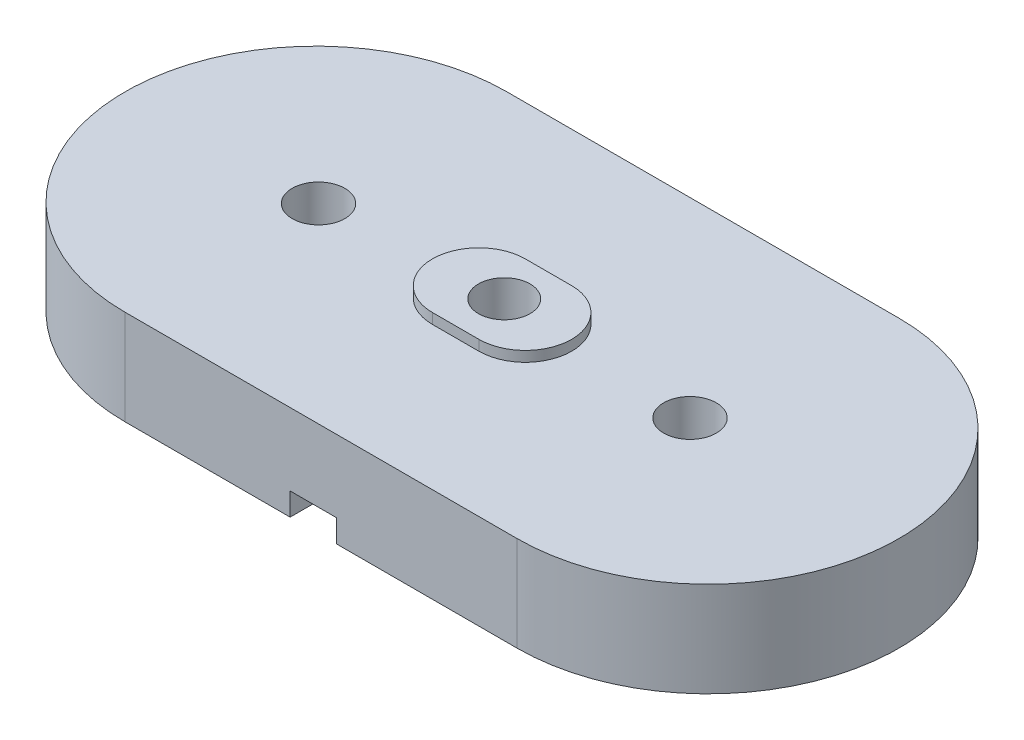
from build123d import *

# Parameters (mm, degrees)
BOSS_EXTRUDE1_DEPTH     = 46
CUT_EXTRUDE1_DEPTH      = 11
SKETCH3_R               = 12.5
CUT_EXTRUDE2_DEPTH      = 300.311710429
SKETCH4_R               = 12.5
BOSS_EXTRUDE2_DEPTH     = 5
CUT_EXTRUDE3_DEPTH      = 301.796442798
CUT_EXTRUDE3_DEPTH_BACK = 301.796442798
SKETCH5_R               = 12.75


with BuildPart() as part:
    # Sketch1 → Boss-Extrude1 (new body)
    with BuildSketch(Plane(origin=(0, 0, 0), x_dir=(1, 0, 0), z_dir=(0, 1, 0))):
        with BuildLine():
            Line((0, 92.5), (190, 92.5))
            ThreePointArc((190, 92.5), (282.5, 0), (190, -92.5))
            Line((190, -92.5), (0, -92.5))
            ThreePointArc((0, -92.5), (-92.5, 0), (0, 92.5))
        make_face()
    extrude(amount=BOSS_EXTRUDE1_DEPTH)

    # Sketch2 → Cut-Extrude1 (cut)
    with BuildSketch(Plane.XZ):
        with BuildLine():
            Line((80, -92.5), (80, -22.5))
            ThreePointArc((80, -22.5), (57.5, 0), (80, 22.5))
            Line((80, 22.5), (80, 92.5))
            Line((80, 92.5), (102.5, 92.5))
            Line((102.5, 92.5), (102.5, 22.5))
            ThreePointArc((102.5, 22.5), (125, 0), (102.5, -22.5))
            Line((102.5, -22.5), (102.5, -92.5))
            Line((102.5, -92.5), (80, -92.5))
        make_face()
    extrude(amount=-CUT_EXTRUDE1_DEPTH, mode=Mode.SUBTRACT)

    # Sketch3 → Cut-Extrude2 (cut, through all)
    with BuildSketch(Plane.XZ.offset(-11)):
        with Locations(Location((91.25, 0, 0), (0, 0, 270))):
            Circle(SKETCH3_R)
    extrude(amount=-CUT_EXTRUDE2_DEPTH, mode=Mode.SUBTRACT)

    # Sketch4 → Boss-Extrude2 (add)
    with BuildSketch(Plane(origin=(0, 46, 0), x_dir=(1, 0, 0), z_dir=(0, 1, 0))):
        with BuildLine():
            ThreePointArc((102.089515, 21.8501808), (124.589515, -0.6498192), (102.089515, -23.1498192))
            Line((102.089515, -23.1498192), (79.589515, -23.1498192))
            ThreePointArc((79.589515, -23.1498192), (57.089515, -0.6498192), (79.589515, 21.8501808))
            Line((79.589515, 21.8501808), (102.089515, 21.8501808))
        make_face()
        with Locations(Location((91.25, 0, 0), (0, 0, 90))):
            Circle(SKETCH4_R, mode=Mode.SUBTRACT)
    extrude(amount=BOSS_EXTRUDE2_DEPTH)

    # Sketch5 → Cut-Extrude3 (cut, two sides: drawn at the far end of the back side and taken through both)
    with BuildSketch(Plane(origin=(0, 46, 0), x_dir=(1, 0, 0), z_dir=(0, 1, 0)).offset(-CUT_EXTRUDE3_DEPTH_BACK)):
        with Locations(Location((1.25, 0, 0), (0, 0, 270))):
            Circle(SKETCH5_R)
        with Locations(Location((181.25, 0, 0), (0, 0, 270))):
            Circle(SKETCH5_R)
    extrude(amount=CUT_EXTRUDE3_DEPTH + CUT_EXTRUDE3_DEPTH_BACK, mode=Mode.SUBTRACT)


solid = part.part
